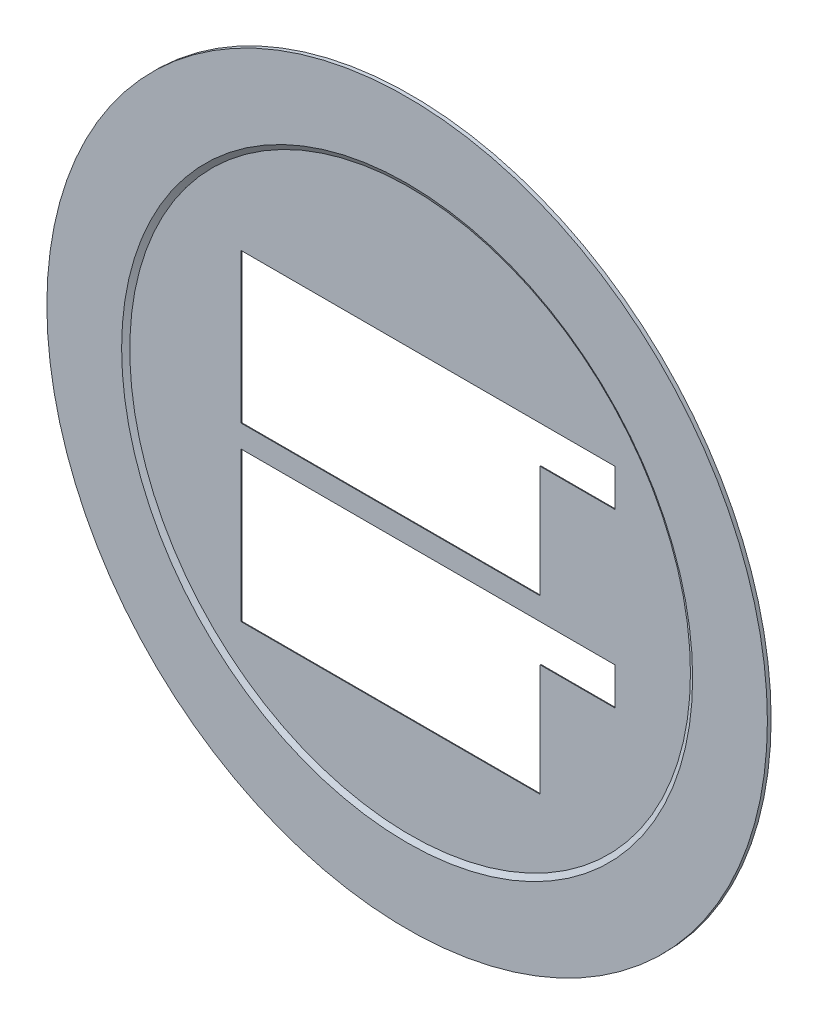
from build123d import *

# Parameters (mm, degrees)
CUT_EXTRUDE1_DEPTH = 69.156113896


with BuildPart() as part:
    # Sketch2 → Revolve1 (revolve)
    with BuildSketch(Plane.YZ):
        Polygon((48.192820323, 0.5), (38.192820323, 0.5), (37.5, 0.1), (0, 0.1), (0, 0), (48.192820323, 0), align=None)
    revolve(axis=Axis((0, 0, 0.1), (0, 0, -1)))

    # Sketch3 → Cut-Extrude1 (cut, through all)
    with BuildSketch(Plane.XY.offset(0.1)):
        Polygon((-22.605575449, 18.919047288), (-22.605575449, -1.080952712), (17.394424551, -1.080952712), (17.394424551, 13.919047288), (27.394424551, 13.919047288), (27.394424551, 18.919047288), align=None)
        Polygon((-22.605575449, -4.080952712), (-22.605575449, -24.080952712), (17.394424551, -24.080952712), (17.394424551, -9.080952712), (27.394424551, -9.080952712), (27.394424551, -4.080952712), align=None)
    extrude(amount=-CUT_EXTRUDE1_DEPTH, mode=Mode.SUBTRACT)


solid = part.part
